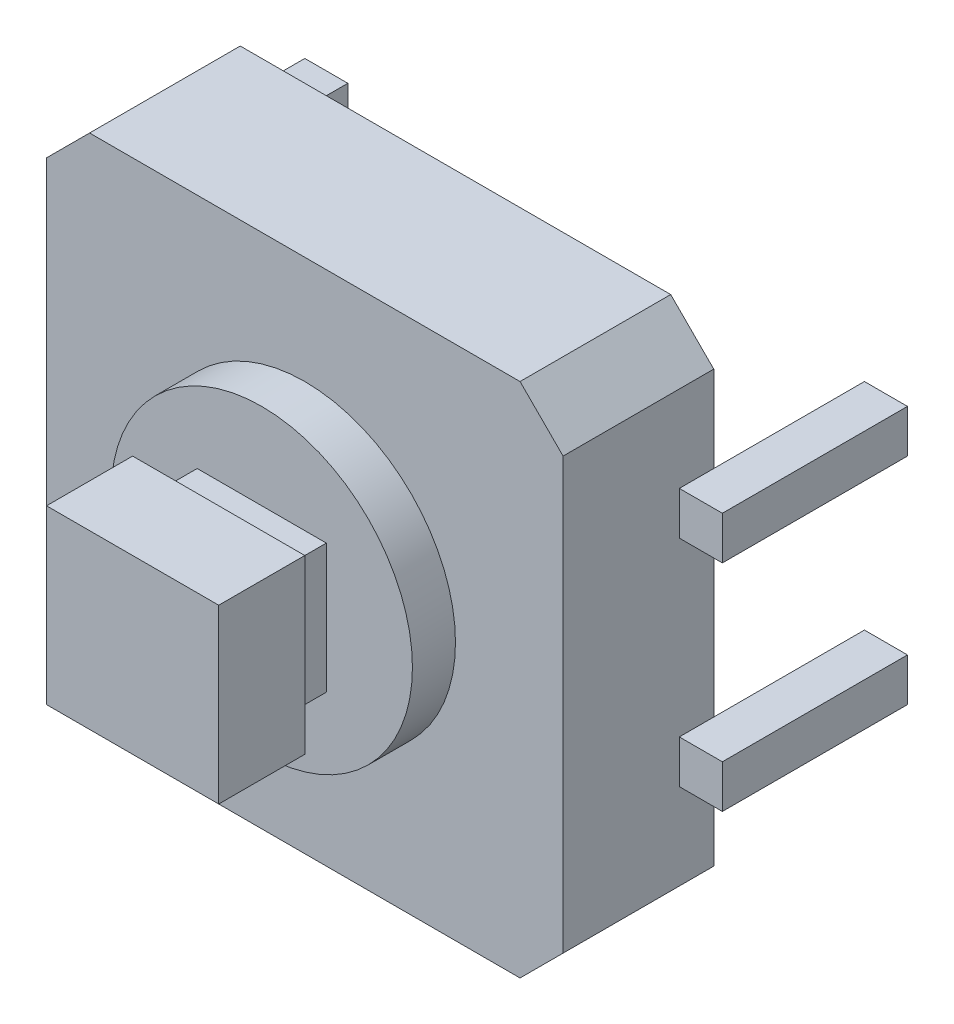
from build123d import *

# Parameters (mm, degrees)
SKETCH_1_W      = 12
SKETCH_1_H      = 12
EXTRUDE_1_DEPTH = 3.5
SKETCH_2_R      = 3.5
EXTRUDE_2_DEPTH = 1
SKETCH_3_W      = 3
SKETCH_3_H      = 3
EXTRUDE_3_DEPTH = 1
SKETCH_4_W      = 4
SKETCH_4_H      = 4
EXTRUDE_4_DEPTH = 2
SKETCH_5_W      = 4.3
SKETCH_5_H      = 1
EXTRUDE_5_DEPTH = 1
SKETCH_7_W      = 4.3
SKETCH_7_H      = 1
EXTRUDE_6_DEPTH = 1
CHAMFER_1_SIZE  = 1


with BuildPart() as part:
    # 스케치1 → 보스-돌출1 (new body)
    with BuildSketch(Plane.XY):
        Rectangle(SKETCH_1_W, SKETCH_1_H)
    extrude(amount=EXTRUDE_1_DEPTH)

    # 스케치2 → 보스-돌출2 (add)
    with BuildSketch(Plane.XY.offset(3.5)):
        Circle(SKETCH_2_R)
    extrude(amount=EXTRUDE_2_DEPTH)

    # 스케치3 → 보스-돌출3 (add)
    with BuildSketch(Plane.XY.offset(4.5)):
        Rectangle(SKETCH_3_W, SKETCH_3_H)
    extrude(amount=EXTRUDE_3_DEPTH)

    # 스케치4 → 보스-돌출4 (add)
    with BuildSketch(Plane.XY.offset(5.5)):
        Rectangle(SKETCH_4_W, SKETCH_4_H)
    extrude(amount=EXTRUDE_4_DEPTH)

    # 스케치5 → 보스-돌출5 (add)
    with BuildSketch(Plane.ZY.offset(6)):
        with Locations((-1.35, 2.5)):
            Rectangle(SKETCH_5_W, SKETCH_5_H)
        with Locations((-1.35, -2.5)):
            Rectangle(SKETCH_5_W, SKETCH_5_H)
    extrude(amount=EXTRUDE_5_DEPTH)

    # 스케치7 → 보스-돌출6 (add)
    with BuildSketch(Plane(origin=(6, 0, 0), x_dir=(0, 0, -1), z_dir=(1, 0, 0))):
        with Locations((1.35, 2.5)):
            Rectangle(SKETCH_7_W, SKETCH_7_H)
        with Locations((1.35, -2.5)):
            Rectangle(SKETCH_7_W, SKETCH_7_H)
    extrude(amount=EXTRUDE_6_DEPTH)

    # 모따기1
    chamfer_1_edges = [part.edges().sort_by_distance(p)[0] for p in [
        (6, -6, 1.75),
        (-6, -6, 1.75),
        (-6, 6, 1.75),
        (6, 6, 1.75),
    ]]
    chamfer(chamfer_1_edges, length=CHAMFER_1_SIZE)


solid = part.part
